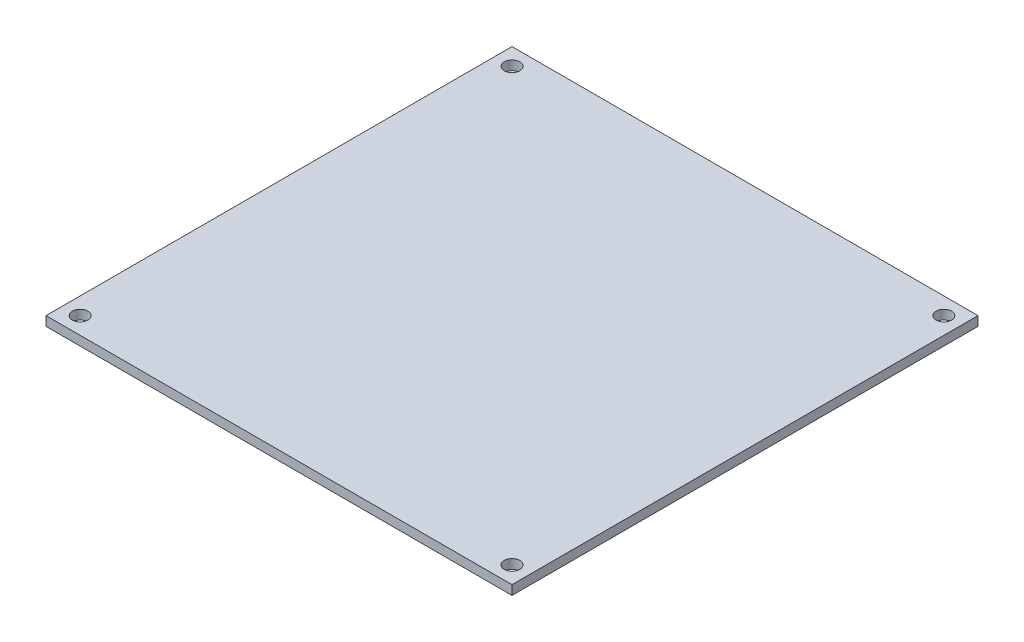
from build123d import *

# Parameters (mm, degrees)
ESBO_O1_W                = 300
ESBO_O1_H                = 300
RESSALTO_EXTRUS_O1_DEPTH = 6
ESBO_O2_R                = 5
CORTE_EXTRUS_O1_DEPTH    = 213.216870206


with BuildPart() as part:
    # Esboço1 → Ressalto-extrusão1 (new body)
    with BuildSketch(Plane(origin=(0, 0, 0), x_dir=(1, 0, 0), z_dir=(0, 1, 0))):
        Rectangle(ESBO_O1_W, ESBO_O1_H)
    extrude(amount=RESSALTO_EXTRUS_O1_DEPTH)

    # Esboço2 → Corte-extrusão1 (cut, through all)
    with BuildSketch(Plane(origin=(0, 6, 0), x_dir=(1, 0, 0), z_dir=(0, 1, 0))):
        with Locations(Location((-139, 139, 0), (0, 0, 270))):
            Circle(ESBO_O2_R)
        with Locations(Location((139, 139, 0), (0, 0, 270))):
            Circle(ESBO_O2_R)
        with Locations(Location((139, -139, 0), (0, 0, 270))):
            Circle(ESBO_O2_R)
        with Locations(Location((-139, -139, 0), (0, 0, 270))):
            Circle(ESBO_O2_R)
    extrude(amount=-CORTE_EXTRUS_O1_DEPTH, mode=Mode.SUBTRACT)


solid = part.part
